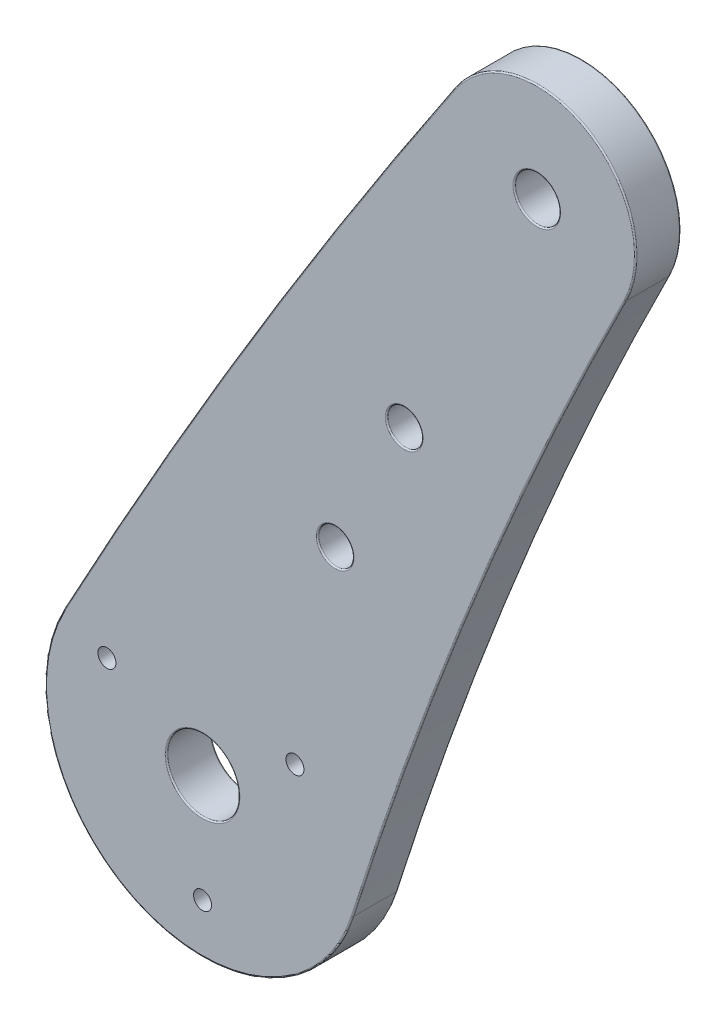
from build123d import *

# Parameters (mm, degrees)
SKETCH1_R              = 4
SKETCH1_R_2            = 2.5
BOSS_EXTRUDE1_DEPTH    = 5
M3_5_CLEARANCE_HOLE1_D = 3.9
FILLET1_R              = 0.15
SKETCH4_R              = 1
CUT_EXTRUDE1_DEPTH     = 10


with BuildPart() as part:
    # Sketch1 → Boss-Extrude1 (new body)
    with BuildSketch(Plane.XY):
        with BuildLine():
            ThreePointArc((7.81529026, 137.794035051), (-14.795505969, 102.372705136), (-35.628022867, 65.877158028))
            ThreePointArc((-35.628022867, 65.877158028), (-27.03707283, 41.462384853), (-3.534584083, 52.302984209))
            ThreePointArc((-3.534584083, 52.302984209), (10.116265304, 90.108007337), (26.759628663, 126.69439714))
            ThreePointArc((26.759628663, 126.69439714), (22.498928134, 141.138904995), (7.81529026, 137.794035051))
        make_face()
        with Locations((-20.22, 57.58)):
            Circle(SKETCH1_R, mode=Mode.SUBTRACT)
        with Locations((16.938125623, 131.647989579)):
            Circle(SKETCH1_R_2, mode=Mode.SUBTRACT)
    extrude(amount=BOSS_EXTRUDE1_DEPTH)

    # M3.5 Clearance Hole1 (through all)
    with Locations(Plane(origin=(0, 0, 0), x_dir=(-1, 0, 0), z_dir=(0, 0, -1))):
        with Locations((-2.200578445, 102.27136004), (5.482452822, 86.95662954)):
            Hole(M3_5_CLEARANCE_HOLE1_D / 2)

    # Fillet1
    fillet1_edges = [part.edges().sort_by_distance(p)[0] for p in [
        (-27.03707283, 41.462384853, 5),
        (-24.22, 57.58, 0),
        (-24.22, 57.58, 5),
        (10.116265304, 90.108007337, 5),
        (14.438125623, 131.647989579, 0),
        (14.438125623, 131.647989579, 5),
        (-7.432452822, 86.95662954, 0),
        (-7.432452822, 86.95662954, 5),
        (0.250578445, 102.27136004, 0),
        (0.250578445, 102.27136004, 5),
        (22.498928134, 141.138904995, 5),
        (10.116265304, 90.108007337, 0),
        (-27.03707283, 41.462384853, 0),
        (-14.795505969, 102.372705136, 0),
        (22.498928134, 141.138904995, 0),
        (-14.795505969, 102.372705136, 5),
    ]]
    fillet(fillet1_edges, radius=FILLET1_R)

    # Sketch4 → Cut-Extrude1 (cut)
    with BuildSketch(Plane.XY.offset(5)):
        with Locations((-20.22, 45.58)):
            Circle(SKETCH4_R)
        with Locations((-30.848517667, 63.58)):
            Circle(SKETCH4_R)
        with Locations((-9.945801565, 63.784566304)):
            Circle(SKETCH4_R)
    extrude(amount=-CUT_EXTRUDE1_DEPTH, mode=Mode.SUBTRACT)


solid = part.part
